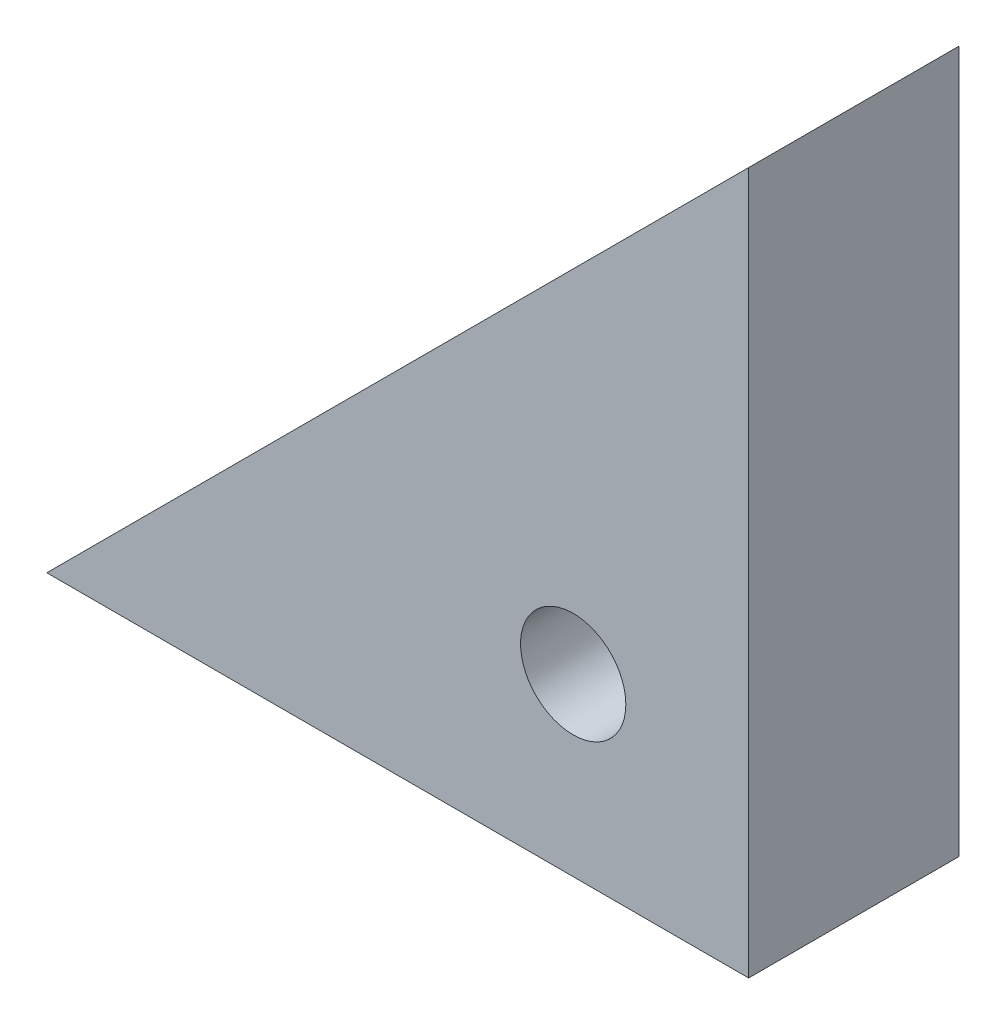
from build123d import *

# Parameters (mm, degrees)
ESBO_O1_R                = 1.5
RESSALTO_EXTRUS_O1_DEPTH = 6


with BuildPart() as part:
    # Esboço1 → Ressalto-extrusão1 (new body)
    with BuildSketch(Plane.XY):
        Polygon((-10, 0), (10, 0), (10, 20), align=None)
        with Locations((5, 5)):
            Circle(ESBO_O1_R, mode=Mode.SUBTRACT)
    extrude(amount=RESSALTO_EXTRUS_O1_DEPTH)


solid = part.part
